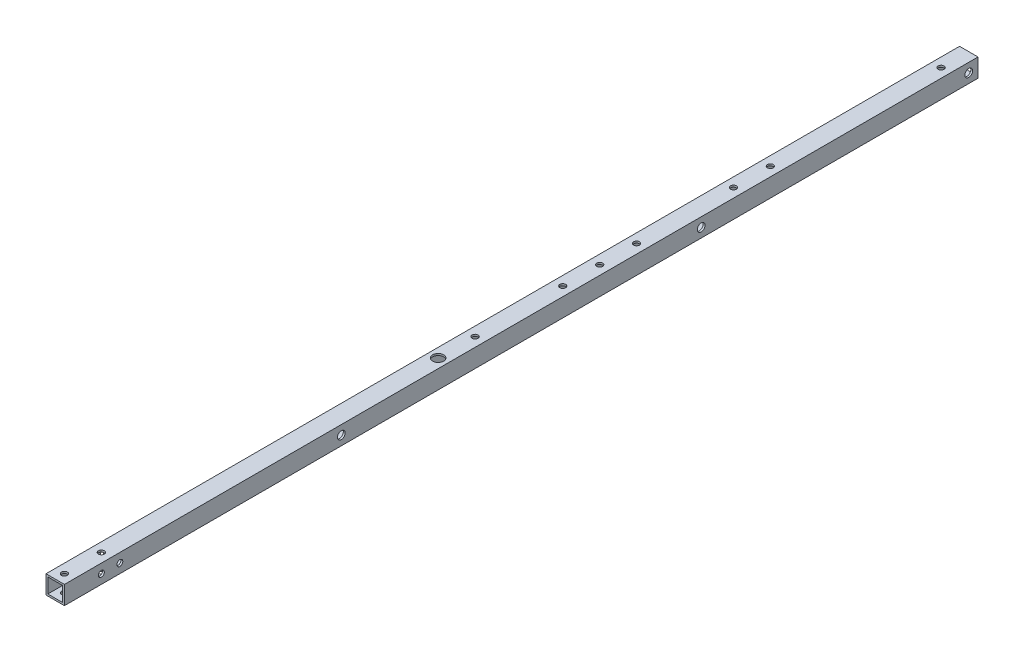
from build123d import *

# Parameters (mm, degrees)
SKETCH_1_W          = 10
SKETCH_1_H          = 10
SKETCH_1_W_2        = 8
SKETCH_1_H_2        = 8
EXTRUDE_1_DEPTH     = 495
SKETCH_3_R          = 2.1
CUT_EXTRUDE_2_DEPTH = 496.126246527
SKETCH_2_R          = 1.6
CUT_EXTRUDE_1_DEPTH = 496.126246527
SKETCH_7_R          = 1.6
CUT_EXTRUDE_4_DEPTH = 496.126246527
SKETCH_9_R          = 2.1
CUT_EXTRUDE_6_DEPTH = 496.126246527
CUT_EXTRUDE_7_REACH = 497.126
SKETCH_10_R         = 3
SKETCH_11_R         = 1.6
CUT_EXTRUDE_8_DEPTH = 496.126246527
SKETCH_12_R         = 1.6
CUT_EXTRUDE_9_DEPTH = 496.126246527


with BuildPart() as part:
    # ｽｹｯﾁ1 → 押し出し-薄板1 (new body)
    with BuildSketch(Plane.XY):
        Rectangle(SKETCH_1_W, SKETCH_1_H)
        Rectangle(SKETCH_1_W_2, SKETCH_1_H_2, mode=Mode.SUBTRACT)
    extrude(amount=EXTRUDE_1_DEPTH)

    # ｽｹｯﾁ3 → ｶｯﾄ - 押し出し2 (cut, through all)
    with BuildSketch(Plane(origin=(5, 0, 0), x_dir=(0, 0, -1), z_dir=(1, 0, 0))):
        with Locations(Location((-5, 0, 0), (0, 0, 90))):
            Circle(SKETCH_3_R)
    extrude(amount=-CUT_EXTRUDE_2_DEPTH, mode=Mode.SUBTRACT)

    # ｽｹｯﾁ2 → ｶｯﾄ - 押し出し1 (cut, through all)
    with BuildSketch(Plane(origin=(0, 5, 0), x_dir=(1, 0, 0), z_dir=(0, 1, 0))):
        with Locations(Location((0, -15, 0), (0, 0, 180))):
            Circle(SKETCH_2_R)
        with Locations(Location((0, -470, 0), (0, 0, 180))):
            Circle(SKETCH_2_R)
        with Locations(Location((0, -490, 0), (0, 0, 180))):
            Circle(SKETCH_2_R)
        with Locations(Location((0, -267.5, 0), (0, 0, 180))):
            Circle(SKETCH_2_R)
        with Locations(Location((0, -287.5, 0), (0, 0, 180))):
            Circle(SKETCH_2_R)
    extrude(amount=-CUT_EXTRUDE_1_DEPTH, mode=Mode.SUBTRACT)

    # ｽｹｯﾁ7 → ｶｯﾄ - 押し出し4 (cut, through all)
    with BuildSketch(Plane(origin=(5, 0, 0), x_dir=(0, 0, -1), z_dir=(1, 0, 0))):
        with Locations(Location((-475, 0, 0), (0, 0, 90))):
            Circle(SKETCH_7_R)
        with Locations(Location((-465, 0, 0), (0, 0, 90))):
            Circle(SKETCH_7_R)
    extrude(amount=-CUT_EXTRUDE_4_DEPTH, mode=Mode.SUBTRACT)

    # ｽｹｯﾁ9 → ｶｯﾄ - 押し出し6 (cut, through all)
    with BuildSketch(Plane(origin=(5, 0, 0), x_dir=(0, 0, -1), z_dir=(1, 0, 0))):
        with Locations(Location((-345, 0, 0), (0, 0, 90))):
            Circle(SKETCH_9_R)
        with Locations(Location((-150, 0, 0), (0, 0, 270))):
            Circle(SKETCH_9_R)
    extrude(amount=-CUT_EXTRUDE_6_DEPTH, mode=Mode.SUBTRACT)

    # ｽｹｯﾁ10 → ｶｯﾄ - 押し出し7 (cut, up to next)
    with BuildSketch(Plane(origin=(0, 5, 0), x_dir=(1, 0, 0), z_dir=(0, 1, 0)), mode=Mode.PRIVATE) as cut_extrude_7_sk1:
        with Locations(Location((0, -287.5, 0), (0, 0, 180))):
            Circle(SKETCH_10_R)
    cut_extrude_7_tool1 = extrude(cut_extrude_7_sk1.sketch, amount=-CUT_EXTRUDE_7_REACH, mode=Mode.PRIVATE) & part.part
    add(cut_extrude_7_tool1.solids().sort_by_distance((0, 5, 287.5))[0], mode=Mode.SUBTRACT)

    # ｽｹｯﾁ11 → ｶｯﾄ - 押し出し8 (cut, through all)
    with BuildSketch(Plane.XZ.offset(5)):
        with Locations((0, 180)):
            Circle(SKETCH_11_R)
        with Locations((0, 200)):
            Circle(SKETCH_11_R)
        with Locations((0, 220)):
            Circle(SKETCH_11_R)
    extrude(amount=-CUT_EXTRUDE_8_DEPTH, mode=Mode.SUBTRACT)

    # ｽｹｯﾁ12 → ｶｯﾄ - 押し出し9 (cut, through all)
    with BuildSketch(Plane.XZ.offset(5)):
        with Locations((0, 127.5)):
            Circle(SKETCH_12_R)
        with Locations((0, 107.5)):
            Circle(SKETCH_12_R)
    extrude(amount=-CUT_EXTRUDE_9_DEPTH, mode=Mode.SUBTRACT)


solid = part.part
